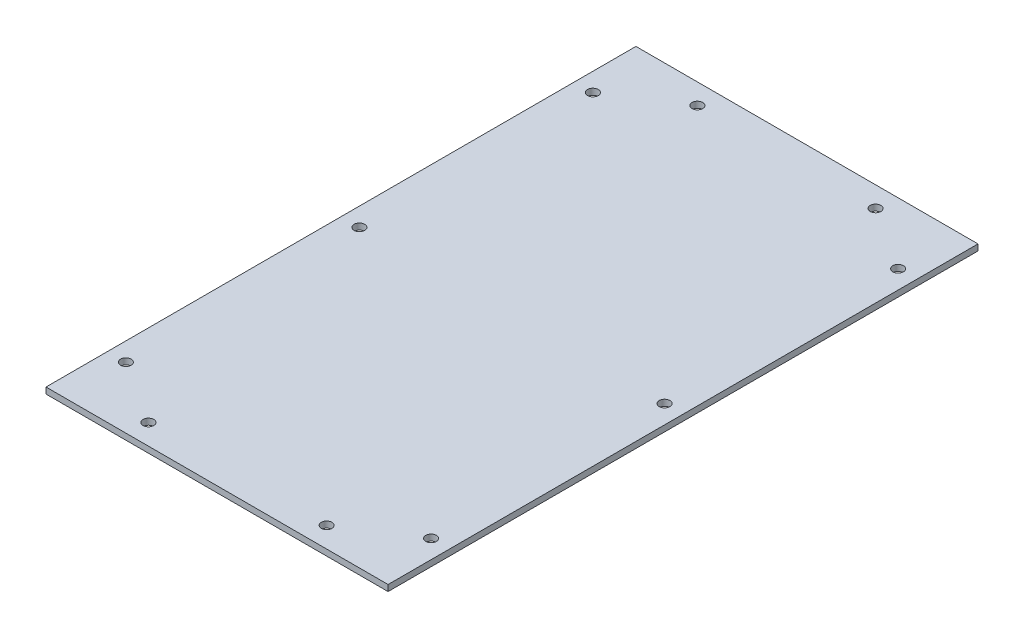
from build123d import *

# Parameters (mm, degrees)
CROQUIS1_W              = 167
CROQUIS1_H              = 288
CROQUIS1_R              = 2.6
SALIENTE_EXTRUIR1_DEPTH = 3


with BuildPart() as part:
    # Croquis1 → Saliente-Extruir1 (new body)
    with BuildSketch(Plane(origin=(0, 0, 0), x_dir=(1, 0, 0), z_dir=(0, 1, 0))):
        Rectangle(CROQUIS1_W, CROQUIS1_H)
        with Locations(Location((-74.5, 114, 0), (0, 0, 270))):
            Circle(CROQUIS1_R, mode=Mode.SUBTRACT)
        with Locations(Location((-74.5, 0, 0), (0, 0, 270))):
            Circle(CROQUIS1_R, mode=Mode.SUBTRACT)
        with Locations(Location((-74.5, -114, 0), (0, 0, 270))):
            Circle(CROQUIS1_R, mode=Mode.SUBTRACT)
        with Locations(Location((74.5, 114, 0), (0, 0, 270))):
            Circle(CROQUIS1_R, mode=Mode.SUBTRACT)
        with Locations(Location((74.5, -114, 0), (0, 0, 270))):
            Circle(CROQUIS1_R, mode=Mode.SUBTRACT)
        with Locations(Location((74.5, 0, 0), (0, 0, 270))):
            Circle(CROQUIS1_R, mode=Mode.SUBTRACT)
        with Locations(Location((-43.5, 134, 0), (0, 0, 270))):
            Circle(CROQUIS1_R, mode=Mode.SUBTRACT)
        with Locations(Location((43.5, 134, 0), (0, 0, 270))):
            Circle(CROQUIS1_R, mode=Mode.SUBTRACT)
        with Locations(Location((-43.5, -134, 0), (0, 0, 270))):
            Circle(CROQUIS1_R, mode=Mode.SUBTRACT)
        with Locations(Location((43.5, -134, 0), (0, 0, 270))):
            Circle(CROQUIS1_R, mode=Mode.SUBTRACT)
    extrude(amount=SALIENTE_EXTRUIR1_DEPTH)


solid = part.part
